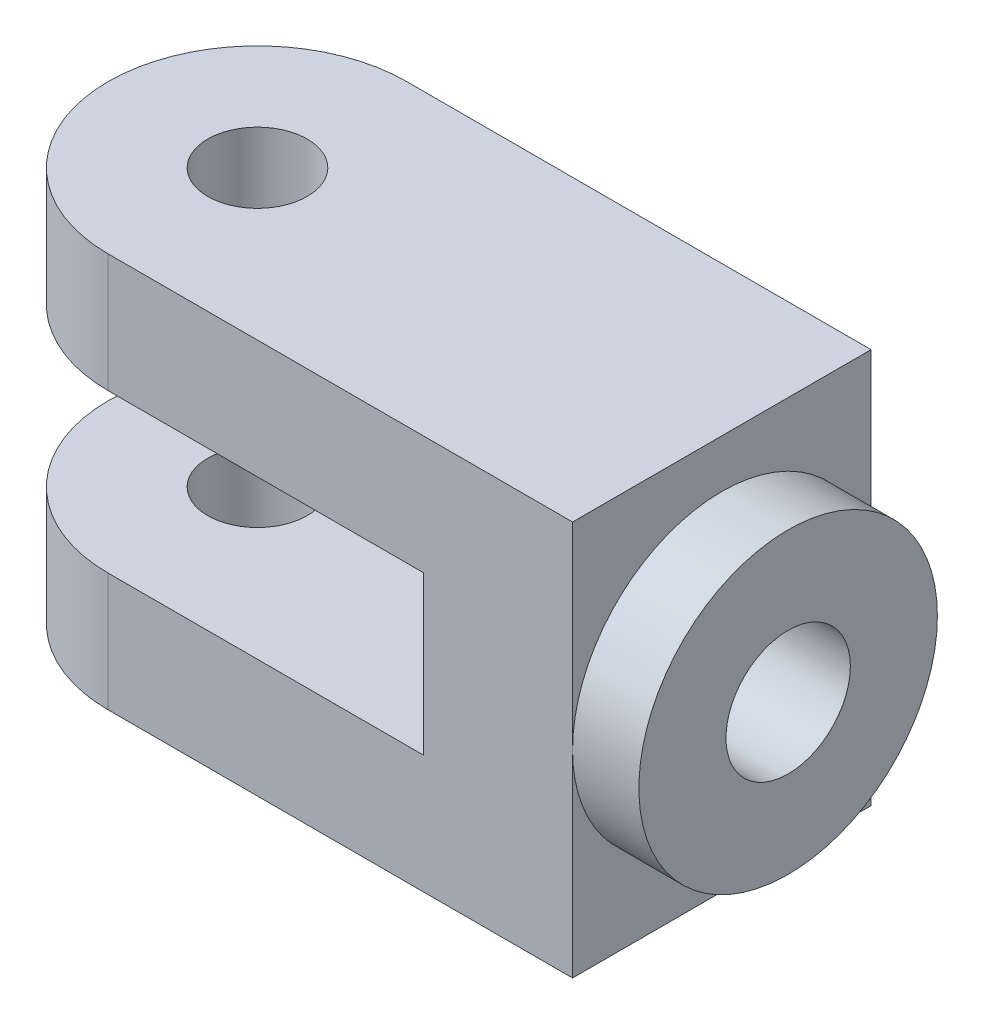
from build123d import *

# Parameters (mm, degrees)
SKETCH1_R           = 12
BOSS_EXTRUDE1_DEPTH = 47.625
CUT_EXTRUDE1_START  = -36
SKETCH2_W           = 72
SKETCH2_H           = 38.1
CUT_EXTRUDE1_DEPTH  = 124.587407476
SKETCH3_R           = 36
BOSS_EXTRUDE2_DEPTH = 16
SKETCH4_R           = 15
CUT_EXTRUDE2_DEPTH  = 175.528337599


with BuildPart() as part:
    # Sketch1 → Boss-Extrude1 (new, symmetric)
    with BuildSketch(Plane(origin=(0, 0, 0), x_dir=(1, 0, 0), z_dir=(0, 1, 0))):
        with BuildLine():
            Line((0, -36), (0, 36))
            Line((0, 36), (-112, 36))
            ThreePointArc((-112, 36), (-148, 0), (-112, -36))
            Line((-112, -36), (0, -36))
        make_face()
        with Locations(Location((-112, 0, 0), (0, 0, 270))):
            Circle(SKETCH1_R, mode=Mode.SUBTRACT)
    extrude(amount=BOSS_EXTRUDE1_DEPTH, both=True)

    # Sketch2 → Cut-Extrude1 (cut, through all)
    with BuildSketch(Plane(origin=(0, 0, 0), x_dir=(0, 0, -1), z_dir=(1, 0, 0)).offset(CUT_EXTRUDE1_START)):
        Rectangle(SKETCH2_W, SKETCH2_H)
    extrude(amount=-CUT_EXTRUDE1_DEPTH, mode=Mode.SUBTRACT)

    # Sketch3 → Boss-Extrude2 (add)
    with BuildSketch(Plane(origin=(0, 0, 0), x_dir=(0, 0, -1), z_dir=(1, 0, 0))):
        Circle(SKETCH3_R)
    extrude(amount=BOSS_EXTRUDE2_DEPTH)

    # Sketch4 → Cut-Extrude2 (cut, through all)
    with BuildSketch(Plane(origin=(16, 0, 0), x_dir=(0, 0, -1), z_dir=(1, 0, 0))):
        Circle(SKETCH4_R)
    extrude(amount=-CUT_EXTRUDE2_DEPTH, mode=Mode.SUBTRACT)


solid = part.part
